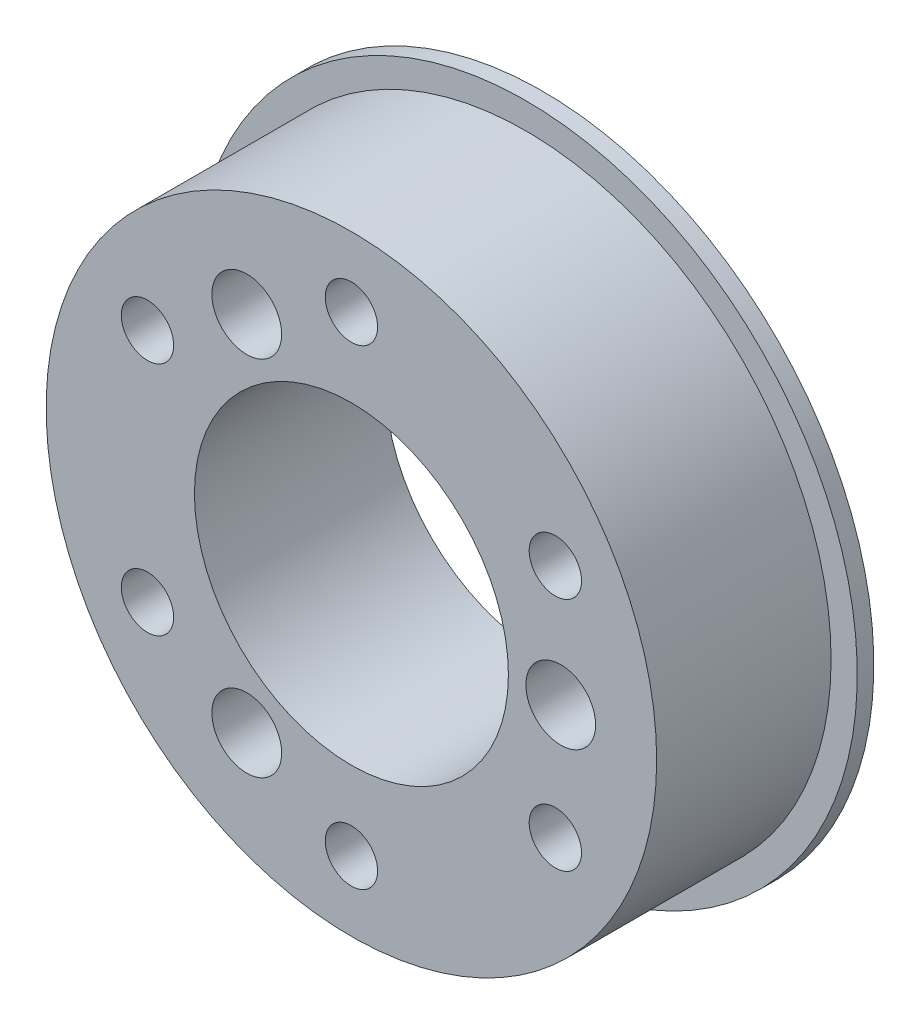
from build123d import *

# Parameters (mm, degrees)
SKETCH_1_R          = 17.5
EXTRUDE_1_DEPTH     = 10.95
SKETCH_1_4_R        = 19
SKETCH_1_4_R_2      = 17.5
EXTRUDE_2_DEPTH     = 0.95
SKETCH_2_R          = 9
SKETCH_2_R_2        = 1.5
SKETCH_2_R_3        = 2
CUT_EXTRUDE_1_DEPTH = 30.015556173


with BuildPart() as part:
    # 草图1 → 凸台-拉伸1 (new body)
    with BuildSketch(Plane.XY):
        Circle(SKETCH_1_R)
    extrude(amount=EXTRUDE_1_DEPTH)

    # 草图1<4> → 凸台-拉伸2 (add)
    with BuildSketch(Plane.XY):
        Circle(SKETCH_1_4_R)
        Circle(SKETCH_1_4_R_2, mode=Mode.SUBTRACT)
    extrude(amount=EXTRUDE_2_DEPTH)

    # 草图2 → 切除-拉伸1 (cut, through all)
    with BuildSketch(Plane.XY.offset(10.95)):
        Circle(SKETCH_2_R)
        with Locations((0, 13.5)):
            Circle(SKETCH_2_R_2)
        with Locations((11.691342951, 6.75)):
            Circle(SKETCH_2_R_2)
        with Locations((11.691342951, -6.75)):
            Circle(SKETCH_2_R_2)
        with Locations((0, -13.5)):
            Circle(SKETCH_2_R_2)
        with Locations((-11.691342951, -6.75)):
            Circle(SKETCH_2_R_2)
        with Locations((-11.691342951, 6.75)):
            Circle(SKETCH_2_R_2)
        with Locations((12, 0)):
            Circle(SKETCH_2_R_3)
        with Locations((-6, -10.392304845)):
            Circle(SKETCH_2_R_3)
        with Locations((-6, 10.392304845)):
            Circle(SKETCH_2_R_3)
    extrude(amount=-CUT_EXTRUDE_1_DEPTH, mode=Mode.SUBTRACT)


solid = part.part
